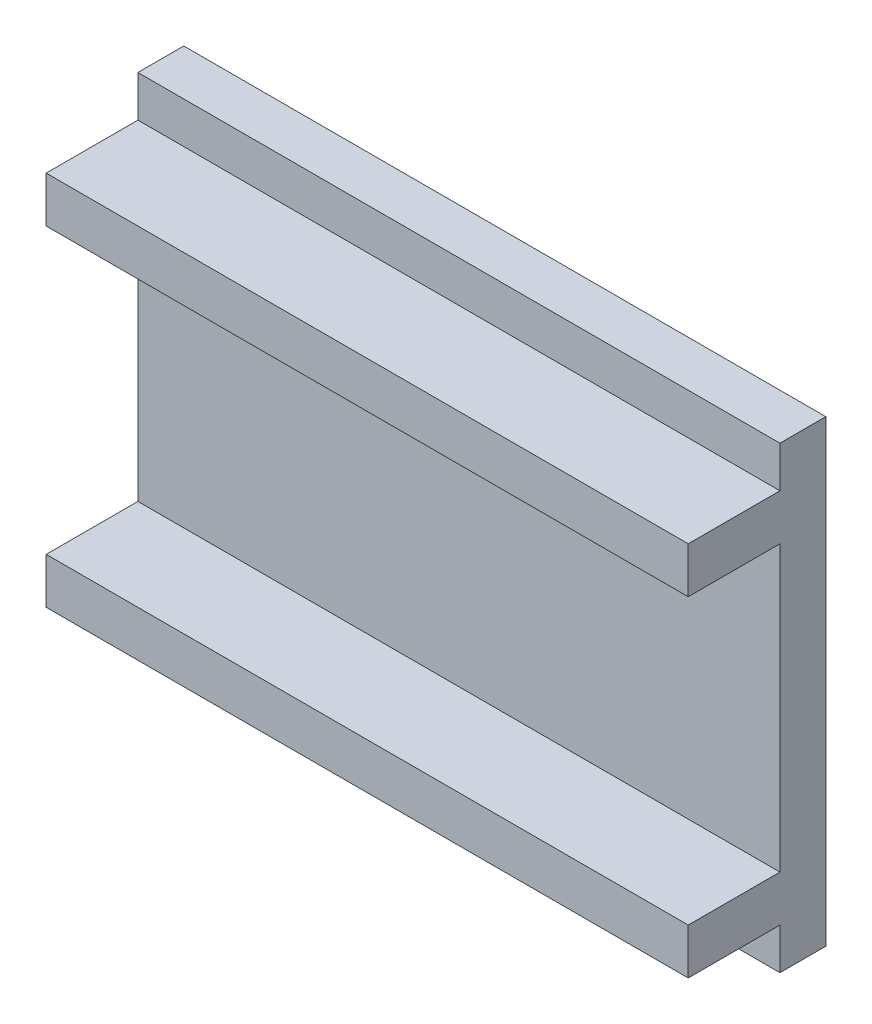
from build123d import *

# Parameters (mm, degrees)
SKETCH1_W           = 70
SKETCH1_H           = 50
BOSS_EXTRUDE1_DEPTH = 5
SKETCH2_W           = 70
SKETCH2_H           = 5
BOSS_EXTRUDE2_DEPTH = 10


with BuildPart() as part:
    # Sketch1 → Boss-Extrude1 (new body)
    with BuildSketch(Plane.XY):
        Rectangle(SKETCH1_W, SKETCH1_H)
    extrude(amount=BOSS_EXTRUDE1_DEPTH)

    # Sketch2 → Boss-Extrude2 (add)
    with BuildSketch(Plane.XY.offset(5)):
        with Locations((0, 18)):
            Rectangle(SKETCH2_W, SKETCH2_H)
    boss_extrude2 = extrude(amount=BOSS_EXTRUDE2_DEPTH)

    # Mirror1: Boss-Extrude2 across plane
    add(boss_extrude2.mirror(Plane.ZX))


solid = part.part
